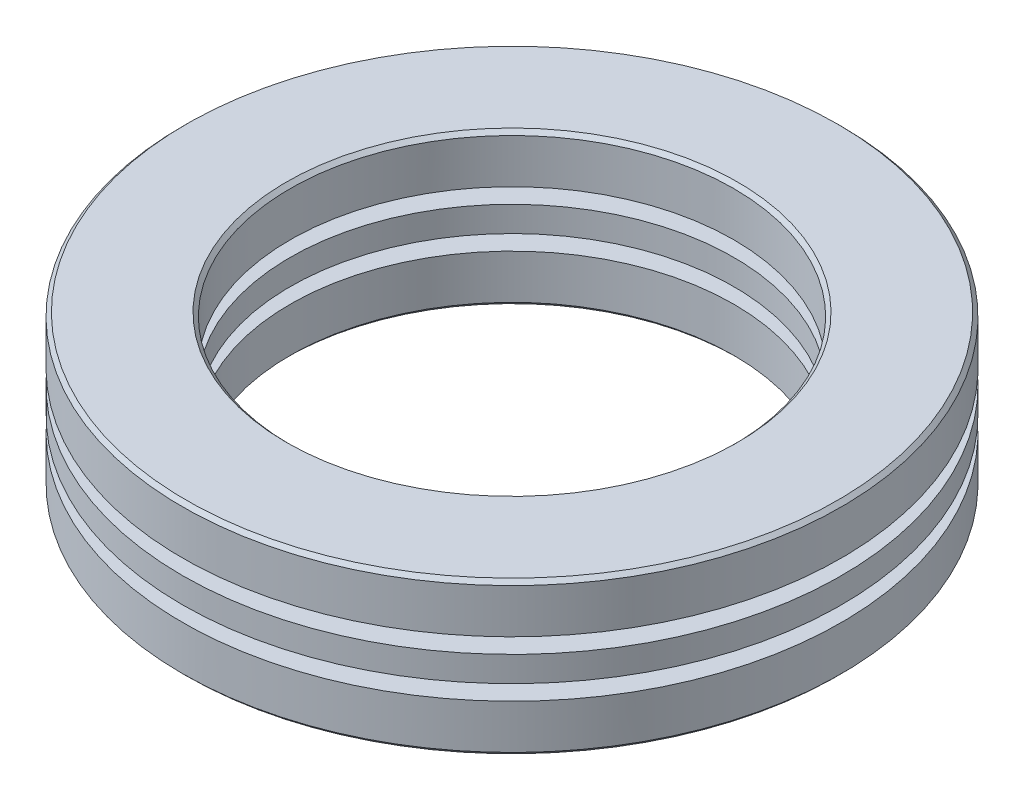
from build123d import *

# Parameters (mm, degrees)
SKETCH1_R           = 26
SKETCH1_R_2         = 17.5
BOSS_EXTRUDE1_DEPTH = 3.8
SKETCH2_R           = 26
SKETCH2_R_2         = 17.5
BOSS_EXTRUDE2_DEPTH = 2
SKETCH3_R           = 26
SKETCH3_R_2         = 17.5
BOSS_EXTRUDE3_DEPTH = 3.8
CIRPATTERN2_COUNT   = 16
CIRPATTERN3_COUNT   = 16
CHAMFER1_SIZE       = 0.3
CHAMFER2_SIZE       = 0.3


with BuildPart() as part:
    # Sketch1 → Boss-Extrude1 (new body)
    with BuildSketch(Plane(origin=(0, 0, 0), x_dir=(1, 0, 0), z_dir=(0, 1, 0))):
        Circle(SKETCH1_R)
        Circle(SKETCH1_R_2, mode=Mode.SUBTRACT)
    extrude(amount=BOSS_EXTRUDE1_DEPTH)

    # Chamfer2
    chamfer2_edges = [part.edges().sort_by_distance(p)[0] for p in [
        (-17.5, 0, 0),
        (-26, 0, 0),
    ]]
    chamfer(chamfer2_edges, length=CHAMFER2_SIZE)


with BuildPart() as body_2:
    # Sketch2 → Boss-Extrude2 (new body)
    with BuildSketch(Plane(origin=(0, 5, 0), x_dir=(1, 0, 0), z_dir=(0, 1, 0))):
        Circle(SKETCH2_R)
        Circle(SKETCH2_R_2, mode=Mode.SUBTRACT)
    extrude(amount=BOSS_EXTRUDE2_DEPTH)

    # Sketch4 → Cut-Revolve1 (revolve, cut)
    with BuildSketch(Plane.XY):
        with BuildLine():
            Line((-23.95, 6), (-19.55, 6))
            ThreePointArc((-19.55, 6), (-21.75, 8.2), (-23.95, 6))
        make_face()
    cut_revolve1 = revolve(axis=Axis((-23.95, 6, 0), (1, 0, 0)), mode=Mode.SUBTRACT)

    # CirPattern2: Cut-Revolve1 ×16 about axis
    cirpattern2_axis = Axis((0, 12, 0), (0, -1, 0))
    for i in range(1, CIRPATTERN2_COUNT):
        add(cut_revolve1.rotate(cirpattern2_axis, i * 360 / CIRPATTERN2_COUNT), mode=Mode.SUBTRACT)


with BuildPart() as body_3:
    # Sketch3 → Boss-Extrude3 (new body)
    with BuildSketch(Plane(origin=(0, 8.2, 0), x_dir=(1, 0, 0), z_dir=(0, 1, 0))):
        Circle(SKETCH3_R)
        Circle(SKETCH3_R_2, mode=Mode.SUBTRACT)
    extrude(amount=BOSS_EXTRUDE3_DEPTH)

    # Chamfer1
    chamfer1_edges = [body_3.edges().sort_by_distance(p)[0] for p in [
        (-17.5, 12, 0),
        (-26, 12, 0),
    ]]
    chamfer(chamfer1_edges, length=CHAMFER1_SIZE)


with BuildPart() as body_4:
    # Sketch4<2> → Revolve1 (revolve)
    with BuildSketch(Plane.XY):
        with BuildLine():
            Line((-23.95, 6), (-19.55, 6))
            ThreePointArc((-19.55, 6), (-21.75, 8.2), (-23.95, 6))
        make_face()
    revolve(axis=Axis((-23.95, 6, 0), (1, 0, 0)))


with BuildPart() as cirpattern3_1:
    # CirPattern3: pattern copy
    add(body_4.part.rotate(Axis((0, 12, 0), (0, -1, 0)), 1 * 360 / CIRPATTERN3_COUNT))


with BuildPart() as cirpattern3_2:
    # CirPattern3: pattern copy
    add(body_4.part.rotate(Axis((0, 12, 0), (0, -1, 0)), 2 * 360 / CIRPATTERN3_COUNT))


with BuildPart() as cirpattern3_3:
    # CirPattern3: pattern copy
    add(body_4.part.rotate(Axis((0, 12, 0), (0, -1, 0)), 3 * 360 / CIRPATTERN3_COUNT))


with BuildPart() as cirpattern3_4:
    # CirPattern3: pattern copy
    add(body_4.part.rotate(Axis((0, 12, 0), (0, -1, 0)), 4 * 360 / CIRPATTERN3_COUNT))


with BuildPart() as cirpattern3_5:
    # CirPattern3: pattern copy
    add(body_4.part.rotate(Axis((0, 12, 0), (0, -1, 0)), 5 * 360 / CIRPATTERN3_COUNT))


with BuildPart() as cirpattern3_6:
    # CirPattern3: pattern copy
    add(body_4.part.rotate(Axis((0, 12, 0), (0, -1, 0)), 6 * 360 / CIRPATTERN3_COUNT))


with BuildPart() as cirpattern3_7:
    # CirPattern3: pattern copy
    add(body_4.part.rotate(Axis((0, 12, 0), (0, -1, 0)), 7 * 360 / CIRPATTERN3_COUNT))


with BuildPart() as cirpattern3_8:
    # CirPattern3: pattern copy
    add(body_4.part.rotate(Axis((0, 12, 0), (0, -1, 0)), 8 * 360 / CIRPATTERN3_COUNT))


with BuildPart() as cirpattern3_9:
    # CirPattern3: pattern copy
    add(body_4.part.rotate(Axis((0, 12, 0), (0, -1, 0)), 9 * 360 / CIRPATTERN3_COUNT))


with BuildPart() as cirpattern3_10:
    # CirPattern3: pattern copy
    add(body_4.part.rotate(Axis((0, 12, 0), (0, -1, 0)), 10 * 360 / CIRPATTERN3_COUNT))


with BuildPart() as cirpattern3_11:
    # CirPattern3: pattern copy
    add(body_4.part.rotate(Axis((0, 12, 0), (0, -1, 0)), 11 * 360 / CIRPATTERN3_COUNT))


with BuildPart() as cirpattern3_12:
    # CirPattern3: pattern copy
    add(body_4.part.rotate(Axis((0, 12, 0), (0, -1, 0)), 12 * 360 / CIRPATTERN3_COUNT))


with BuildPart() as cirpattern3_13:
    # CirPattern3: pattern copy
    add(body_4.part.rotate(Axis((0, 12, 0), (0, -1, 0)), 13 * 360 / CIRPATTERN3_COUNT))


with BuildPart() as cirpattern3_14:
    # CirPattern3: pattern copy
    add(body_4.part.rotate(Axis((0, 12, 0), (0, -1, 0)), 14 * 360 / CIRPATTERN3_COUNT))


with BuildPart() as cirpattern3_15:
    # CirPattern3: pattern copy
    add(body_4.part.rotate(Axis((0, 12, 0), (0, -1, 0)), 15 * 360 / CIRPATTERN3_COUNT))


solid = Compound([part.part, body_2.part, body_3.part, body_4.part, cirpattern3_1.part, cirpattern3_2.part, cirpattern3_3.part, cirpattern3_4.part, cirpattern3_5.part, cirpattern3_6.part, cirpattern3_7.part, cirpattern3_8.part, cirpattern3_9.part, cirpattern3_10.part, cirpattern3_11.part, cirpattern3_12.part, cirpattern3_13.part, cirpattern3_14.part, cirpattern3_15.part])
